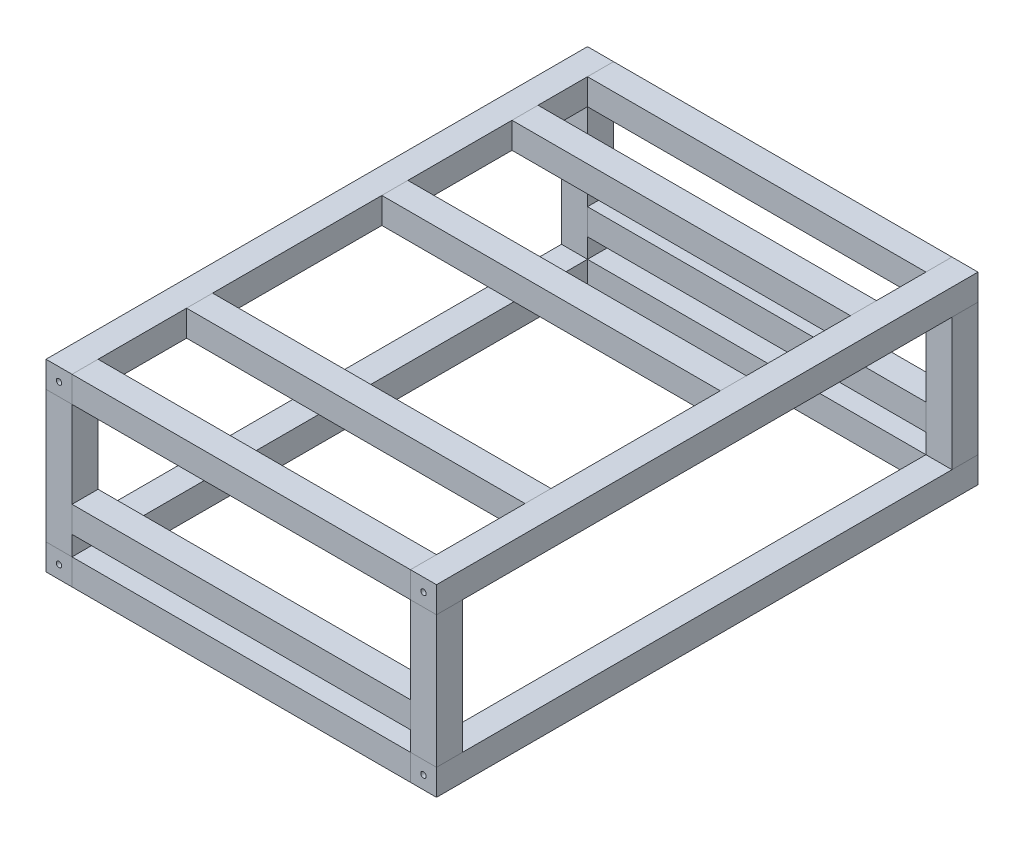
from build123d import *

# Parameters (mm, degrees)
SK_BOTSIDERAILS_W       = 20
SK_BOTSIDERAILS_H       = 20
SK_BOTSIDERAILS_R       = 2.1
EX_BOTSIDERAILS_DEPTH   = 416
EX_BOTSIDERAILS_2_DEPTH = 416
SK_TOPSIDERAILS_W       = 20
SK_TOPSIDERAILS_H       = 20
SK_TOPSIDERAILS_R       = 2.1
EX_TOPSIDERAILS_DEPTH   = 416
EX_TOPSIDERAILS_2_DEPTH = 416
SK_BOTENDRAILS_W        = 20
SK_BOTENDRAILS_H        = 20
SK_BOTENDRAILS_R        = 2.1
EX_BOTENDRAILS_DEPTH    = 260
EX_BOTENDRAILS_2_DEPTH  = 260
SK_TOPENDRAILS_W        = 20
SK_TOPENDRAILS_H        = 20
SK_TOPENDRAILS_R        = 2.1
EX_TOPENDRAILS_DEPTH    = 260
EX_TOPENDRAILS_2_DEPTH  = 260
SK_MIDCROSS_W           = 20
SK_MIDCROSS_H           = 20
SK_MIDCROSS_R           = 2.1
EX_MIDCROSS_DEPTH       = 260
EX_MIDCROSS_2_DEPTH     = 260
SK_TOPCROSS_W           = 20
SK_TOPCROSS_H           = 20
SK_TOPCROSS_R           = 2.1
EX_TOPCROSS_DEPTH       = 260
EX_TOPCROSS_2_DEPTH     = 260
EX_TOPCROSS_3_DEPTH     = 260
SK_UPRIGHTS_W           = 20
SK_UPRIGHTS_H           = 20
SK_UPRIGHTS_R           = 2.1
EX_UPRIGHTS_DEPTH       = 101.5
EX_UPRIGHTS_2_DEPTH     = 101.5
EX_UPRIGHTS_3_DEPTH     = 101.5
EX_UPRIGHTS_4_DEPTH     = 101.5


with BuildPart() as part:
    # SK_BotSideRails → EX_BotSideRails (new body)
    with BuildSketch(Plane.XY.offset(-208)):
        with Locations((140, 46.5)):
            Rectangle(SK_BOTSIDERAILS_W, SK_BOTSIDERAILS_H)
        with Locations((140, 46.5)):
            Circle(SK_BOTSIDERAILS_R, mode=Mode.SUBTRACT)
    extrude(amount=EX_BOTSIDERAILS_DEPTH)


with BuildPart() as body_2:
    # SK_BotSideRails → EX_BotSideRails 2 (new body)
    with BuildSketch(Plane.XY.offset(-208)):
        with Locations((-140, 46.5)):
            Rectangle(SK_BOTSIDERAILS_W, SK_BOTSIDERAILS_H)
        with Locations((-140, 46.5)):
            Circle(SK_BOTSIDERAILS_R, mode=Mode.SUBTRACT)
    extrude(amount=EX_BOTSIDERAILS_2_DEPTH)


with BuildPart() as body_3:
    # SK_TopSideRails → EX_TopSideRails (new body)
    with BuildSketch(Plane.XY.offset(-208)):
        with Locations((140, 168)):
            Rectangle(SK_TOPSIDERAILS_W, SK_TOPSIDERAILS_H)
        with Locations((140, 168)):
            Circle(SK_TOPSIDERAILS_R, mode=Mode.SUBTRACT)
    extrude(amount=EX_TOPSIDERAILS_DEPTH)


with BuildPart() as body_4:
    # SK_TopSideRails → EX_TopSideRails 2 (new body)
    with BuildSketch(Plane.XY.offset(-208)):
        with Locations((-140, 168)):
            Rectangle(SK_TOPSIDERAILS_W, SK_TOPSIDERAILS_H)
        with Locations((-140, 168)):
            Circle(SK_TOPSIDERAILS_R, mode=Mode.SUBTRACT)
    extrude(amount=EX_TOPSIDERAILS_2_DEPTH)


with BuildPart() as body_5:
    # SK_BotEndRails → EX_BotEndRails (new body)
    with BuildSketch(Plane(origin=(-130, 0, 0), x_dir=(0, 0, -1), z_dir=(1, 0, 0))):
        with Locations((-198, 46.5)):
            Rectangle(SK_BOTENDRAILS_W, SK_BOTENDRAILS_H)
        with Locations((-198, 46.5)):
            Circle(SK_BOTENDRAILS_R, mode=Mode.SUBTRACT)
    extrude(amount=EX_BOTENDRAILS_DEPTH)


with BuildPart() as body_6:
    # SK_BotEndRails → EX_BotEndRails 2 (new body)
    with BuildSketch(Plane(origin=(-130, 0, 0), x_dir=(0, 0, -1), z_dir=(1, 0, 0))):
        with Locations((198, 46.5)):
            Rectangle(SK_BOTENDRAILS_W, SK_BOTENDRAILS_H)
        with Locations((198, 46.5)):
            Circle(SK_BOTENDRAILS_R, mode=Mode.SUBTRACT)
    extrude(amount=EX_BOTENDRAILS_2_DEPTH)


with BuildPart() as body_7:
    # SK_TopEndRails → EX_TopEndRails (new body)
    with BuildSketch(Plane(origin=(-130, 0, 0), x_dir=(0, 0, -1), z_dir=(1, 0, 0))):
        with Locations((-198, 168)):
            Rectangle(SK_TOPENDRAILS_W, SK_TOPENDRAILS_H)
        with Locations((-198, 168)):
            Circle(SK_TOPENDRAILS_R, mode=Mode.SUBTRACT)
    extrude(amount=EX_TOPENDRAILS_DEPTH)


with BuildPart() as body_8:
    # SK_TopEndRails → EX_TopEndRails 2 (new body)
    with BuildSketch(Plane(origin=(-130, 0, 0), x_dir=(0, 0, -1), z_dir=(1, 0, 0))):
        with Locations((198, 168)):
            Rectangle(SK_TOPENDRAILS_W, SK_TOPENDRAILS_H)
        with Locations((198, 168)):
            Circle(SK_TOPENDRAILS_R, mode=Mode.SUBTRACT)
    extrude(amount=EX_TOPENDRAILS_2_DEPTH)


with BuildPart() as body_9:
    # SK_MidCross → EX_MidCross (new body)
    with BuildSketch(Plane(origin=(-130, 0, 0), x_dir=(0, 0, -1), z_dir=(1, 0, 0))):
        with Locations((-198, 81.5)):
            Rectangle(SK_MIDCROSS_W, SK_MIDCROSS_H)
        with Locations((-198, 81.5)):
            Circle(SK_MIDCROSS_R, mode=Mode.SUBTRACT)
    extrude(amount=EX_MIDCROSS_DEPTH)


with BuildPart() as body_10:
    # SK_MidCross → EX_MidCross 2 (new body)
    with BuildSketch(Plane(origin=(-130, 0, 0), x_dir=(0, 0, -1), z_dir=(1, 0, 0))):
        with Locations((198, 81.5)):
            Rectangle(SK_MIDCROSS_W, SK_MIDCROSS_H)
        with Locations((198, 81.5)):
            Circle(SK_MIDCROSS_R, mode=Mode.SUBTRACT)
    extrude(amount=EX_MIDCROSS_2_DEPTH)


with BuildPart() as body_11:
    # SK_TopCross → EX_TopCross (new body)
    with BuildSketch(Plane(origin=(-130, 0, 0), x_dir=(0, 0, -1), z_dir=(1, 0, 0))):
        with Locations((40, 168)):
            Rectangle(SK_TOPCROSS_W, SK_TOPCROSS_H)
        with Locations((40, 168)):
            Circle(SK_TOPCROSS_R, mode=Mode.SUBTRACT)
    extrude(amount=EX_TOPCROSS_DEPTH)


with BuildPart() as body_12:
    # SK_TopCross → EX_TopCross 2 (new body)
    with BuildSketch(Plane(origin=(-130, 0, 0), x_dir=(0, 0, -1), z_dir=(1, 0, 0))):
        with Locations((140, 168)):
            Rectangle(SK_TOPCROSS_W, SK_TOPCROSS_H)
        with Locations((140, 168)):
            Circle(SK_TOPCROSS_R, mode=Mode.SUBTRACT)
    extrude(amount=EX_TOPCROSS_2_DEPTH)


with BuildPart() as body_13:
    # SK_TopCross → EX_TopCross 3 (new body)
    with BuildSketch(Plane(origin=(-130, 0, 0), x_dir=(0, 0, -1), z_dir=(1, 0, 0))):
        with Locations((-110, 168)):
            Rectangle(SK_TOPCROSS_W, SK_TOPCROSS_H)
        with Locations((-110, 168)):
            Circle(SK_TOPCROSS_R, mode=Mode.SUBTRACT)
    extrude(amount=EX_TOPCROSS_3_DEPTH)


with BuildPart() as body_14:
    # SK_Uprights → EX_Uprights (new body)
    with BuildSketch(Plane(origin=(0, 56.5, 0), x_dir=(1, 0, 0), z_dir=(0, 1, 0))):
        with Locations((140, -198)):
            Rectangle(SK_UPRIGHTS_W, SK_UPRIGHTS_H)
        with Locations((140, -198)):
            Circle(SK_UPRIGHTS_R, mode=Mode.SUBTRACT)
    extrude(amount=EX_UPRIGHTS_DEPTH)


with BuildPart() as body_15:
    # SK_Uprights → EX_Uprights 2 (new body)
    with BuildSketch(Plane(origin=(0, 56.5, 0), x_dir=(1, 0, 0), z_dir=(0, 1, 0))):
        with Locations((-140, -198)):
            Rectangle(SK_UPRIGHTS_W, SK_UPRIGHTS_H)
        with Locations((-140, -198)):
            Circle(SK_UPRIGHTS_R, mode=Mode.SUBTRACT)
    extrude(amount=EX_UPRIGHTS_2_DEPTH)


with BuildPart() as body_16:
    # SK_Uprights → EX_Uprights 3 (new body)
    with BuildSketch(Plane(origin=(0, 56.5, 0), x_dir=(1, 0, 0), z_dir=(0, 1, 0))):
        with Locations((140, 198)):
            Rectangle(SK_UPRIGHTS_W, SK_UPRIGHTS_H)
        with Locations((140, 198)):
            Circle(SK_UPRIGHTS_R, mode=Mode.SUBTRACT)
    extrude(amount=EX_UPRIGHTS_3_DEPTH)


with BuildPart() as body_17:
    # SK_Uprights → EX_Uprights 4 (new body)
    with BuildSketch(Plane(origin=(0, 56.5, 0), x_dir=(1, 0, 0), z_dir=(0, 1, 0))):
        with Locations((-140, 198)):
            Rectangle(SK_UPRIGHTS_W, SK_UPRIGHTS_H)
        with Locations((-140, 198)):
            Circle(SK_UPRIGHTS_R, mode=Mode.SUBTRACT)
    extrude(amount=EX_UPRIGHTS_4_DEPTH)


solid = Compound([part.part, body_2.part, body_3.part, body_4.part, body_5.part, body_6.part, body_7.part, body_8.part, body_9.part, body_10.part, body_11.part, body_12.part, body_13.part, body_14.part, body_15.part, body_16.part, body_17.part])
